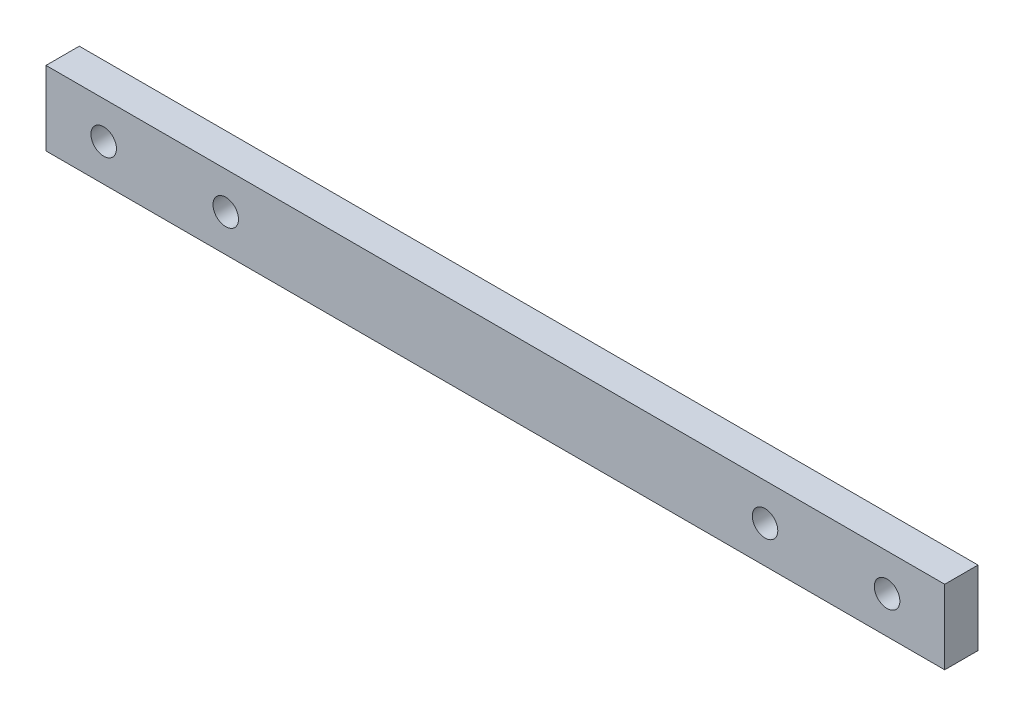
from build123d import *

# Parameters (mm, degrees)
SKETCH_1_W      = 80.994
SKETCH_1_H      = 6.68
SKETCH_1_R      = 1.15
EXTRUDE_1_DEPTH = 3


with BuildPart() as part:
    # 草图1 → 凸台-拉伸1 (new body)
    with BuildSketch(Plane.XY):
        with Locations((0, -13.93)):
            Rectangle(SKETCH_1_W, SKETCH_1_H)
        with Locations((-35.297, -13.93)):
            Circle(SKETCH_1_R, mode=Mode.SUBTRACT)
        with Locations((-24.297, -13.93)):
            Circle(SKETCH_1_R, mode=Mode.SUBTRACT)
        with Locations((24.303, -13.93)):
            Circle(SKETCH_1_R, mode=Mode.SUBTRACT)
        with Locations((35.303, -13.93)):
            Circle(SKETCH_1_R, mode=Mode.SUBTRACT)
    extrude(amount=EXTRUDE_1_DEPTH)


solid = part.part
